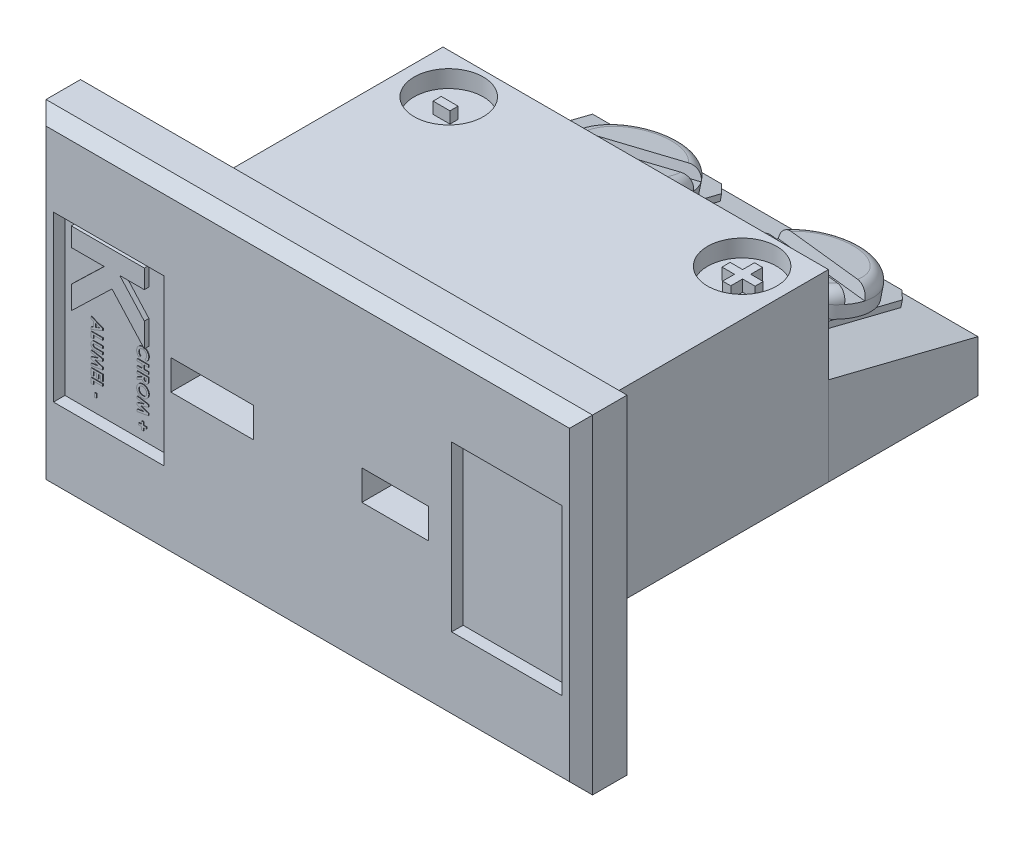
from build123d import *

# Parameters (mm, degrees)
SKETCH1_W                    = 23.75
SKETCH1_H                    = 14.3
SKETCH1_W_2                  = 3.6
SKETCH1_H_2                  = 1.3
SKETCH1_W_3                  = 2.9
EXTRUDE1_DEPTH               = 2
CHAMFER1_SIZE                = 0.5
SKETCH2_W                    = 4.8
SKETCH2_H                    = 7.15
CUT_EXTRUDE1_DEPTH           = 0.5
SKETCH3_W                    = 16.75
SKETCH3_H                    = 8
SKETCH3_W_2                  = 2.9
SKETCH3_H_2                  = 1.3
SKETCH3_W_3                  = 3.6
EXTRUDE2_DEPTH               = 12.25
TC_TYPE_DEPTH                = 0.2
SKETCH5_W                    = 2.9
SKETCH5_H                    = 0.5
CONATCTS_DEPTH               = 12.25
SKETCH5_W_2                  = 3.6
CONATCTS_2_DEPTH             = 12.25
EXTRUDE5_DEPTH               = 6.5
CUT_EXTRUDE2_DEPTH           = 24.317388898
CUT_EXTRUDE2_DEPTH_BACK      = 24.317388898
CONTACT_EXTENSION_DEPTH      = 0.2
CONTACT_EXTENSION_DEPTH_BACK = 0.2
SKETCH8_W                    = 2
SKETCH8_H                    = 2
CONTACT_PLATE_DEPTH          = 0.265
CONTACT_PLATE_DEPTH_BACK     = 0.265
SKETCH10_R                   = 2.25
SCREW_HEAD_DEPTH             = 1
FILLET1_R                    = 0.5
SCREW_SLOT_DEPTH             = 0.5
SKETCH12_R                   = 1.25
SCREW_DEPTH                  = 3.5
SCREW_2_DEPTH                = 3.5
SKETCH13_R                   = 1.5
CUT_EXTRUDE4_DEPTH           = 0.75
POSITIVE_DEPTH               = 0.5
SKETCH16_W                   = 0.732692307
SKETCH16_H                   = 0.352777778
NEGATIVE_DEPTH               = 0.5
TEMINAL_INFO_DEPTH           = 0.025
TEMINAL_INFO_2_DEPTH         = 0.025
TEMINAL_INFO_3_DEPTH         = 0.025
TEMINAL_INFO_4_DEPTH         = 0.025
TEMINAL_INFO_5_DEPTH         = 0.025
TEMINAL_INFO_6_DEPTH         = 0.025
TEMINAL_INFO_7_DEPTH         = 0.025
TEMINAL_INFO_8_DEPTH         = 0.025
TEMINAL_INFO_9_DEPTH         = 0.025
TEMINAL_INFO_10_DEPTH        = 0.025
TEMINAL_INFO_11_DEPTH        = 0.025
TEMINAL_INFO_12_DEPTH        = 0.025
SKETCH17_W                   = 0.083333333
SKETCH17_H                   = 0.173076923
TEMINAL_INFO_13_DEPTH        = 0.025
SKETCH18_W                   = 16.75
SKETCH18_H                   = 0.25
MOUNTING_SLOT_DEPTH          = 3.75


with BuildPart() as part:
    # Sketch1 → Extrude1 (new body)
    with BuildSketch(Plane.XY):
        Rectangle(SKETCH1_W, SKETCH1_H)
        with Locations((-4.15, 0)):
            Rectangle(SKETCH1_W_2, SKETCH1_H_2, mode=Mode.SUBTRACT)
        with Locations((3.8, 0)):
            Rectangle(SKETCH1_W_3, SKETCH1_H_2, mode=Mode.SUBTRACT)
    extrude(amount=EXTRUDE1_DEPTH)

    # Chamfer1
    chamfer1_edges = [part.edges().sort_by_distance(p)[0] for p in [
        (11.875, 0, 2),
        (0, 7.15, 2),
        (-11.875, 0, 2),
        (0, -7.15, 2),
    ]]
    chamfer(chamfer1_edges, length=CHAMFER1_SIZE)

    # Sketch2 → Cut-Extrude1 (cut)
    with BuildSketch(Plane.XY.offset(2)):
        with Locations((8.65, 0)):
            Rectangle(SKETCH2_W, SKETCH2_H)
        with Locations((-8.65, 0)):
            Rectangle(SKETCH2_W, SKETCH2_H)
    extrude(amount=-CUT_EXTRUDE1_DEPTH, mode=Mode.SUBTRACT)

    # Sketch3 → Extrude2 (add)
    with BuildSketch(Plane(origin=(0, 0, 0), x_dir=(-1, 0, 0), z_dir=(0, 0, -1))):
        Rectangle(SKETCH3_W, SKETCH3_H)
        with Locations((-3.8, 0)):
            Rectangle(SKETCH3_W_2, SKETCH3_H_2, mode=Mode.SUBTRACT)
        with Locations((4.15, 0)):
            Rectangle(SKETCH3_W_3, SKETCH3_H_2, mode=Mode.SUBTRACT)
    extrude(amount=EXTRUDE2_DEPTH)

    # Sketch4 → TC Type (add)
    with BuildSketch(Plane(origin=(4.986962707, -4.591876201, 1.5), x_dir=(0, -1, 0), z_dir=(0, 0, 1))):
        Polygon((-7.734521618, -12.389716307), (-6.920419053, -12.389716307), (-6.920419053, -13.455681852), (-5.738062283, -12.389716307), (-4.690541249, -12.389716307), (-6.24814842, -13.79404323), (-4.539169053, -15.564716307), (-5.535172659, -15.564716307), (-6.920419053, -14.12922452), (-6.920419053, -15.564716307), (-7.734521618, -15.564716307), align=None)
    extrude(amount=TC_TYPE_DEPTH)

    # Sketch13 → Cut-Extrude4 (cut)
    with BuildSketch(Plane(origin=(0, 4, 0), x_dir=(1, 0, 0), z_dir=(0, 1, 0))):
        with Locations(Location((6.375, 10.5, 0), (0, 0, 180))):
            Circle(SKETCH13_R)
        with Locations((-6.375, 10.5)):
            Circle(SKETCH13_R)
    extrude(amount=-CUT_EXTRUDE4_DEPTH, mode=Mode.SUBTRACT)

    # Sketch15 → Positive (add)
    with BuildSketch(Plane(origin=(0, 3.25, 0), x_dir=(1, 0, 0), z_dir=(0, 1, 0))):
        Polygon((6.26232318, 10.634212166), (6.26232318, 11.149810456), (6.615100958, 11.149810456), (6.615100958, 10.634212166), (7.157836001, 10.634212166), (7.157836001, 10.281434388), (6.615100958, 10.281434388), (6.615100958, 9.765836098), (6.26232318, 9.765836098), (6.26232318, 10.281434388), (5.719588138, 10.281434388), (5.719588138, 10.634212166), align=None)
    extrude(amount=POSITIVE_DEPTH)

    # Sketch16 → Negative (add)
    with BuildSketch(Plane(origin=(0, 3.25, 0), x_dir=(1, 0, 0), z_dir=(0, 1, 0))):
        with Locations((-6.437463802, 10.426631522)):
            Rectangle(SKETCH16_W, SKETCH16_H)
    extrude(amount=NEGATIVE_DEPTH)

    # Sketch18 → Mounting Slot (cut)
    with BuildSketch(Plane(origin=(0, 4, 0), x_dir=(1, 0, 0), z_dir=(0, 1, 0))):
        with Locations((0, 0.125)):
            Rectangle(SKETCH18_W, SKETCH18_H)
    extrude(amount=-MOUNTING_SLOT_DEPTH, mode=Mode.SUBTRACT)


with BuildPart() as body_2:
    # Sketch5 → Conatcts (new body)
    with BuildSketch(Plane(origin=(0, 0, 0), x_dir=(-1, 0, 0), z_dir=(0, 0, -1))):
        with Locations((-3.8, -0.4)):
            Rectangle(SKETCH5_W, SKETCH5_H)
    extrude(amount=CONATCTS_DEPTH)


with BuildPart() as body_3:
    # Sketch5 → Conatcts 2 (new body)
    with BuildSketch(Plane(origin=(0, 0, 0), x_dir=(-1, 0, 0), z_dir=(0, 0, -1))):
        with Locations((4.15, -0.4)):
            Rectangle(SKETCH5_W_2, SKETCH5_H)
    extrude(amount=CONATCTS_2_DEPTH)


with BuildPart() as body_4:
    # Sketch6 → Extrude5 (new body)
    with BuildSketch(Plane(origin=(0, 0, -12.25), x_dir=(-1, 0, 0), z_dir=(0, 0, -1))):
        Polygon((-8.375, -4), (8.375, -4), (8.375, -0.15), (5.95, -0.15), (5.95, -0.65), (2.35, -0.65), (2.35, -0.15), (-2.35, -0.15), (-2.35, -0.65), (-5.25, -0.65), (-5.25, -0.15), (-8.375, -0.15), align=None)
    extrude(amount=EXTRUDE5_DEPTH)

    # Sketch7 → Cut-Extrude2 (cut, two sides: drawn at the far end of the back side and taken through both)
    with BuildSketch(Plane(origin=(0, 0, 0), x_dir=(0, 0, -1), z_dir=(1, 0, 0)).offset(-CUT_EXTRUDE2_DEPTH_BACK)):
        Polygon((12.25, -0.15), (20.25, -0.15), (20.25, -2.15), align=None)
    extrude(amount=CUT_EXTRUDE2_DEPTH + CUT_EXTRUDE2_DEPTH_BACK, mode=Mode.SUBTRACT)

    # Sketch8 → Contact Extension (add, two sides: drawn at the far end of the back side and taken through both)
    with BuildSketch(Plane(origin=(0, -0.65, 0), x_dir=(-1, 0, 0), z_dir=(0, 1, 0)).offset(-CONTACT_EXTENSION_DEPTH_BACK)):
        with Locations((-3.75, -13.25)):
            Rectangle(SKETCH8_W, SKETCH8_H)
        with Locations((4.15, -13.25)):
            Rectangle(SKETCH8_W, SKETCH8_H)
    extrude(amount=CONTACT_EXTENSION_DEPTH + CONTACT_EXTENSION_DEPTH_BACK)

    # Sketch9 → Contact Plate (add, two sides: drawn at the far end of the back side and taken through both)
    with BuildSketch(Plane(origin=(0, 2.741176471, -0.685294118), x_dir=(-1, 0, 0), z_dir=(0, 0.9701425001453319, -0.24253562503633302)).offset(-CONTACT_PLATE_DEPTH_BACK)):
        Polygon((6.15, -13.982178783), (2.15, -13.982178783), (2.15, -17.920672612), (2.65, -18.420672612), (5.65, -18.420672612), (6.15, -17.920672612), align=None)
        Polygon((-1.8, -13.982178783), (-5.8, -13.982178783), (-5.8, -17.820672612), (-5.3, -18.320672612), (-2.3, -18.320672612), (-1.8, -17.820672612), align=None)
    extrude(amount=CONTACT_PLATE_DEPTH + CONTACT_PLATE_DEPTH_BACK)

    # Sketch10 → Screw Head (add)
    with BuildSketch(Plane(origin=(0, 2.998264233, -0.749566058), x_dir=(-1, 0, 0), z_dir=(0, 0.9701425001453319, -0.2425356250363331))):
        with Locations(Location((-3.75, -15.733671658, 0), (0, 0, 330.073565133))):
            Circle(SKETCH10_R)
        with Locations(Location((4.15, -15.733671658, 0), (0, 0, 332.733955549))):
            Circle(SKETCH10_R)
    extrude(amount=SCREW_HEAD_DEPTH)

    # Fillet1
    fillet1_edges = [body_4.edges().sort_by_distance(p)[0] for p in [
        (5.7, 0.424676407, -15.167022987),
        (-2.15, 0.402430844, -15.256005242),
    ]]
    fillet(fillet1_edges, radius=FILLET1_R)

    # Sketch11 → Screw Slot (cut)
    with BuildSketch(Plane(origin=(0, 3.968406733, -0.992101683), x_dir=(-1, 0, 0), z_dir=(0, 0.9701425001453319, -0.2425356250363331))):
        Polygon((-8.004493959, -15.514840567), (-0.01596153, -16.684812948), (-0.012575312, -15.876774602), (-7.999326122, -14.70706315), align=None)
        Polygon((1.350792573, -16.684812948), (7.832864588, -13.446866174), (8.12818877, -14.193601578), (1.70829056, -17.40049108), align=None)
    extrude(amount=-SCREW_SLOT_DEPTH, mode=Mode.SUBTRACT)


with BuildPart() as body_5:
    # Sketch12 → Screw (new body)
    with BuildSketch(Plane(origin=(0, 2.706110032, -0.825559871), x_dir=(1, 0, 0), z_dir=(0, -0.9701425001453319, 0.24253562503633302))):
        with Locations(Location((3.75, -15.589089029, 0), (0, 0, 270))):
            Circle(SKETCH12_R)
    extrude(amount=SCREW_DEPTH)


with BuildPart() as body_6:
    # Sketch12 → Screw 2 (new body)
    with BuildSketch(Plane(origin=(0, 2.706110032, -0.825559871), x_dir=(1, 0, 0), z_dir=(0, -0.9701425001453319, 0.24253562503633302))):
        with Locations(Location((-4.15, -15.589089029, 0), (0, 0, 270))):
            Circle(SKETCH12_R)
    extrude(amount=SCREW_2_DEPTH)


with BuildPart() as body_7:
    # Sketch17 → Teminal Info (new body)
    with BuildSketch(Plane.XY.offset(1.5)):
        with BuildLine():
            Line((-7.483592845, -0.506410256), (-7.546493486, -0.440604968))
            add(Edge.make_bspline(
                [(-7.546493486, -0.440604968), (-7.54071413, -0.435028804), (-7.529406863, -0.42411908), (-7.514587891, -0.406464723), (-7.502045909, -0.388268799), (-7.491613941, -0.369653666), (-7.483655918, -0.350332043), (-7.477934511, -0.330558235), (-7.474371882, -0.310224747), (-7.473976489, -0.296488723), (-7.473777139, -0.289563301)],
                knots=[0, 0, 0, 0, 1.115306757, 2.182089883, 3.196083701, 4.1824169, 5.141279108, 6.092660653, 7.038358735, 8, 8, 8, 8], degree=3))
            add(Edge.make_bspline(
                [(-7.473777139, -0.289563301), (-7.473937236, -0.283780283), (-7.474253169, -0.272368133), (-7.476569271, -0.255612107), (-7.480507902, -0.239584101), (-7.485936065, -0.224229251), (-7.492959821, -0.209592738), (-7.501573732, -0.195643874), (-7.511700003, -0.182417051), (-7.523286241, -0.170086986), (-7.535945076, -0.158807876), (-7.549452022, -0.148842065), (-7.563776137, -0.140494099), (-7.578772356, -0.133643059), (-7.594510088, -0.128306364), (-7.61097874, -0.124495293), (-7.628197922, -0.122291071), (-7.639903395, -0.121962077), (-7.64585246, -0.121794872)],
                knots=[0, 0, 0, 0, 1.035432265, 2.043311493, 3.022114605, 3.98653278, 4.95457646, 5.923598177, 6.917315552, 7.932509744, 8.948865224, 9.949768934, 10.933144597, 11.912367597, 12.897413939, 13.903909035, 14.934704909, 16, 16, 16, 16], degree=3))
            add(Edge.make_bspline(
                [(-7.64585246, -0.121794872), (-7.650027951, -0.121842997), (-7.658257931, -0.121937853), (-7.670431989, -0.122978422), (-7.682245118, -0.124649316), (-7.693672834, -0.127083956), (-7.704759354, -0.130074039), (-7.715501702, -0.133790095), (-7.725893422, -0.138203266), (-7.735914917, -0.143188526), (-7.745450561, -0.148814873), (-7.754502566, -0.1550235), (-7.762955679, -0.161875245), (-7.77109906, -0.169049995), (-7.778446434, -0.17703378), (-7.785423788, -0.185455709), (-7.791793855, -0.19449511), (-7.797729458, -0.203949724), (-7.802885093, -0.2139052), (-7.807555289, -0.224090351), (-7.811348136, -0.234659895), (-7.81440553, -0.245485063), (-7.817005382, -0.256527191), (-7.818606193, -0.267894276), (-7.819818467, -0.279487781), (-7.819893318, -0.287323044), (-7.819930986, -0.291266026)],
                knots=[0, 0, 0, 0, 1.103757074, 2.175527871, 3.227929046, 4.25632503, 5.262816555, 6.262237806, 7.259082723, 8.246028863, 9.219500025, 10.184246818, 11.145149257, 12.095245763, 13.050780899, 14.010384931, 14.985255937, 15.972438916, 16.959582425, 17.947317807, 18.933039374, 19.924907969, 20.920697008, 21.929431285, 22.958016685, 24, 24, 24, 24], degree=3))
            add(Edge.make_bspline(
                [(-7.819930986, -0.291266026), (-7.819737245, -0.297953901), (-7.819356597, -0.311093838), (-7.816388515, -0.330380264), (-7.811476291, -0.348781927), (-7.805733525, -0.363508292), (-7.800047649, -0.375025441), (-7.794715052, -0.38371427), (-7.788852643, -0.392758887), (-7.782099074, -0.401959236), (-7.774586285, -0.411415905), (-7.766139404, -0.420955828), (-7.757039551, -0.430825026), (-7.75054468, -0.437290169), (-7.747214639, -0.440604968)],
                knots=[0, 0, 0, 0, 1.404522537, 2.759521553, 4.088271485, 5.398566954, 6.072955186, 6.783849712, 7.538645654, 8.336900766, 9.180343671, 10.075042757, 11.013038782, 12, 12, 12, 12], degree=3))
            Line((-7.747214639, -0.440604968), (-7.814221851, -0.504407051))
            add(Edge.make_bspline(
                [(-7.814221851, -0.504407051), (-7.818551923, -0.499922108), (-7.827003297, -0.491168459), (-7.839003457, -0.47796382), (-7.849786945, -0.464775804), (-7.859745106, -0.451922989), (-7.868588004, -0.439194888), (-7.876323878, -0.426592661), (-7.883150451, -0.41425963), (-7.888945407, -0.401937377), (-7.893897329, -0.389528089), (-7.898073536, -0.376765616), (-7.901719079, -0.363643861), (-7.904587933, -0.350054149), (-7.906923378, -0.336057116), (-7.908466589, -0.321607785), (-7.909536709, -0.306773667), (-7.909628245, -0.296743431), (-7.909674575, -0.291666667)],
                knots=[0, 0, 0, 0, 1.244537013, 2.429070097, 3.56066612, 4.644477994, 5.67429546, 6.652817684, 7.595405349, 8.486886006, 9.369351459, 10.26090686, 11.166404474, 12.086719576, 13.0323422, 13.998023148, 14.9867073, 16, 16, 16, 16], degree=3))
            add(Edge.make_bspline(
                [(-7.909674575, -0.291666667), (-7.909436442, -0.282341638), (-7.90897048, -0.26409515), (-7.905529907, -0.23735282), (-7.899723764, -0.211927247), (-7.891623831, -0.187772746), (-7.881106112, -0.164963241), (-7.868344068, -0.1434272), (-7.853216574, -0.123200487), (-7.835949016, -0.10445715), (-7.816874435, -0.087508223), (-7.796401417, -0.072510399), (-7.774382938, -0.060158764), (-7.75129065, -0.049679036), (-7.72676353, -0.041826072), (-7.70102321, -0.036109806), (-7.673959228, -0.032631488), (-7.655478216, -0.032247247), (-7.64605278, -0.032051282)],
                knots=[0, 0, 0, 0, 1.07798487, 2.109316747, 3.111276023, 4.08905949, 5.049398091, 6.009992678, 6.978127636, 7.964347882, 8.951383687, 9.924270623, 10.892397886, 11.86520058, 12.851549246, 13.863953586, 14.910602472, 16, 16, 16, 16], degree=3))
            add(Edge.make_bspline(
                [(-7.64605278, -0.032051282), (-7.639906004, -0.032137697), (-7.627724596, -0.03230895), (-7.609764133, -0.033965988), (-7.592306791, -0.036572287), (-7.575406272, -0.040156215), (-7.558968399, -0.044779643), (-7.543101422, -0.05046187), (-7.527739592, -0.057227999), (-7.512981133, -0.065048174), (-7.498744246, -0.073706162), (-7.485277203, -0.08341883), (-7.472435157, -0.093888593), (-7.460385255, -0.105373564), (-7.44908009, -0.117717352), (-7.438381032, -0.130885951), (-7.428488527, -0.145038501), (-7.41935398, -0.159971493), (-7.411009945, -0.175450468), (-7.403835635, -0.191367184), (-7.39766763, -0.207575259), (-7.392648916, -0.224067746), (-7.38887359, -0.240921074), (-7.386021847, -0.257999263), (-7.384426391, -0.27544381), (-7.384165331, -0.287156449), (-7.38403355, -0.29306891)],
                knots=[0, 0, 0, 0, 1.072042128, 2.124525481, 3.143421661, 4.149789678, 5.136208088, 6.119957821, 7.087418232, 8.061778743, 9.031690376, 9.991741907, 10.955971237, 11.919971873, 12.892764515, 13.874218568, 14.877632952, 15.902487591, 16.926514439, 17.94307752, 18.945815567, 19.949956505, 20.947454389, 21.956649761, 22.968530506, 24, 24, 24, 24], degree=3))
            add(Edge.make_bspline(
                [(-7.38403355, -0.29306891), (-7.384109107, -0.298112836), (-7.384259435, -0.308148246), (-7.385512583, -0.323092654), (-7.387480641, -0.337917544), (-7.39045002, -0.352569838), (-7.393975048, -0.367154344), (-7.398590587, -0.381479406), (-7.403735474, -0.395771008), (-7.409885137, -0.409805009), (-7.416598049, -0.423600998), (-7.424214091, -0.436835782), (-7.432264582, -0.449731572), (-7.441225983, -0.462002604), (-7.450773249, -0.473878743), (-7.460950922, -0.485297885), (-7.471928694, -0.496159823), (-7.479685139, -0.502976172), (-7.483592845, -0.506410256)],
                knots=[0, 0, 0, 0, 0.996412454, 1.982464992, 2.961075852, 3.949442424, 4.934965278, 5.923860011, 6.921385422, 7.934793307, 8.949617135, 9.951082467, 10.950285876, 11.951772932, 12.951063433, 13.960125323, 14.972308753, 16, 16, 16, 16], degree=3))
        make_face()
    extrude(amount=TEMINAL_INFO_DEPTH)


with BuildPart() as body_8:
    # Sketch17 → Teminal Info 2 (new body)
    with BuildSketch(Plane.XY.offset(1.5)):
        Polygon((-7.396854062, -0.596153846), (-7.396854062, -0.685897436), (-7.589161755, -0.685897436), (-7.589161755, -0.858974359), (-7.396854062, -0.858974359), (-7.396854062, -0.948717949), (-7.896854062, -0.948717949), (-7.896854062, -0.858974359), (-7.678905345, -0.858974359), (-7.678905345, -0.685897436), (-7.896854062, -0.685897436), (-7.896854062, -0.596153846), align=None)
    extrude(amount=TEMINAL_INFO_2_DEPTH)


with BuildPart() as body_9:
    # Sketch17 → Teminal Info 3 (new body)
    with BuildSketch(Plane.XY.offset(1.5)):
        with BuildLine():
            Line((-7.396854062, -1.064102564), (-7.396854062, -1.168669872))
            add(Edge.make_bspline(
                [(-7.396854062, -1.168669872), (-7.39687852, -1.17558175), (-7.39692556, -1.188875239), (-7.397670998, -1.208043547), (-7.398703601, -1.2256529), (-7.400298682, -1.241759527), (-7.402361311, -1.256299702), (-7.4048637, -1.26930422), (-7.407690718, -1.280780634), (-7.411155667, -1.29088394), (-7.415145939, -1.299976519), (-7.419649809, -1.308428349), (-7.424837463, -1.316388412), (-7.430498699, -1.324002812), (-7.436836283, -1.331135638), (-7.443798856, -1.337767125), (-7.451336233, -1.343982543), (-7.459403088, -1.349790118), (-7.467988161, -1.354958196), (-7.47696955, -1.359536858), (-7.486371526, -1.363298659), (-7.496140263, -1.366430917), (-7.50628751, -1.368842564), (-7.516806678, -1.370479983), (-7.527702239, -1.371690705), (-7.535105051, -1.371759685), (-7.538881306, -1.371794872)],
                knots=[0, 0, 0, 0, 1.749037589, 3.363891962, 4.853828513, 6.212420965, 7.458679178, 8.568887289, 9.562757098, 10.447168552, 11.268163578, 12.073310924, 12.867792413, 13.67045336, 14.472446998, 15.279188696, 16.101356728, 16.943088626, 17.792208908, 18.634830833, 19.491484118, 20.351879174, 21.228996054, 22.12769993, 23.044919519, 24, 24, 24, 24], degree=3))
            add(Edge.make_bspline(
                [(-7.538881306, -1.371794872), (-7.542822772, -1.371702877), (-7.550551267, -1.371522493), (-7.561903797, -1.370550843), (-7.572765103, -1.368774972), (-7.583103385, -1.366085158), (-7.593047315, -1.362993566), (-7.602413422, -1.358882541), (-7.611337922, -1.354242843), (-7.619694573, -1.34873241), (-7.627668995, -1.342684979), (-7.634955658, -1.335651943), (-7.641946192, -1.328088936), (-7.648202733, -1.319570814), (-7.654148328, -1.310473062), (-7.659536619, -1.30061492), (-7.664503058, -1.290060723), (-7.667272687, -1.2826406), (-7.668688998, -1.278846154)],
                knots=[0, 0, 0, 0, 1.099860209, 2.156625411, 3.176576793, 4.16617041, 5.135385252, 6.078461593, 7.016046972, 7.938469504, 8.868247731, 9.803980173, 10.76021508, 11.73834243, 12.748633912, 13.790971185, 14.870363756, 16, 16, 16, 16], degree=3))
            Line((-7.668688998, -1.278846154), (-7.896854062, -1.394230769))
            Line((-7.896854062, -1.394230769), (-7.896854062, -1.294471154))
            Line((-7.896854062, -1.294471154), (-7.678905345, -1.184294872))
            Line((-7.678905345, -1.184294872), (-7.678905345, -1.153846154))
            Line((-7.678905345, -1.153846154), (-7.896854062, -1.153846154))
            Line((-7.896854062, -1.153846154), (-7.896854062, -1.064102564))
            Line((-7.896854062, -1.064102564), (-7.396854062, -1.064102564))
        make_face()
        with BuildLine():
            Line((-7.589161755, -1.153846154), (-7.589161755, -1.188802083))
            add(Edge.make_bspline(
                [(-7.589161755, -1.188802083), (-7.589113623, -1.193075737), (-7.58902146, -1.201258865), (-7.588593957, -1.213027268), (-7.587563937, -1.223715822), (-7.58626241, -1.233370264), (-7.584760035, -1.242039701), (-7.582605592, -1.249645122), (-7.580301258, -1.256309063), (-7.577423843, -1.261935844), (-7.57420914, -1.266762854), (-7.570396027, -1.270808875), (-7.566218964, -1.274373274), (-7.561415044, -1.277169219), (-7.556181084, -1.279428163), (-7.550418611, -1.280829087), (-7.544231961, -1.281940587), (-7.539922129, -1.282013395), (-7.537679383, -1.282051282)],
                knots=[0, 0, 0, 0, 1.688935225, 3.233948049, 4.651771667, 5.929878493, 7.083962697, 8.124219224, 9.050753627, 9.864999381, 10.615157594, 11.334035464, 12.05533055, 12.777108108, 13.522027315, 14.29964284, 15.115170198, 16, 16, 16, 16], degree=3))
            add(Edge.make_bspline(
                [(-7.537679383, -1.282051282), (-7.535029504, -1.281949492), (-7.529824308, -1.281749545), (-7.522330753, -1.279765336), (-7.515394557, -1.27660715), (-7.509049, -1.272277247), (-7.50348031, -1.266827654), (-7.498611429, -1.260584386), (-7.494671659, -1.253455339), (-7.492148435, -1.246807387), (-7.490597498, -1.240717091), (-7.489496534, -1.235238659), (-7.488642889, -1.228877365), (-7.487816498, -1.221668705), (-7.487247673, -1.213581679), (-7.486845199, -1.204631221), (-7.486678199, -1.194812274), (-7.486625274, -1.187967427), (-7.486597652, -1.184395032)],
                knots=[0, 0, 0, 0, 1.020213939, 2.004021227, 2.966357326, 3.948562114, 4.950324333, 5.960000531, 6.991850424, 8.080015304, 8.69218159, 9.414443227, 10.233931419, 11.166782034, 12.212677862, 13.359889063, 14.622099264, 16, 16, 16, 16], degree=3))
            Line((-7.486597652, -1.184395032), (-7.486597652, -1.153846154))
            Line((-7.486597652, -1.153846154), (-7.589161755, -1.153846154))
        make_face(mode=Mode.SUBTRACT)
    extrude(amount=TEMINAL_INFO_3_DEPTH)


with BuildPart() as body_10:
    # Sketch17 → Teminal Info 4 (new body)
    with BuildSketch(Plane.XY.offset(1.5)):
        with BuildLine():
            add(Edge.make_bspline(
                [(-7.38403355, -1.702924679), (-7.384258496, -1.711617863), (-7.38470259, -1.728780175), (-7.388408608, -1.754018524), (-7.394436717, -1.778345077), (-7.402862926, -1.801754679), (-7.413739558, -1.824215536), (-7.427111392, -1.845670065), (-7.442770264, -1.866256774), (-7.460687412, -1.885595599), (-7.480266497, -1.903334506), (-7.501141363, -1.918931113), (-7.5230791, -1.932134612), (-7.546060256, -1.94293211), (-7.570132692, -1.951293091), (-7.595283838, -1.957129265), (-7.621467271, -1.960887516), (-7.639295587, -1.961319112), (-7.648356466, -1.961538462)],
                knots=[0, 0, 0, 0, 1.014244935, 2.002349224, 2.970143685, 3.935298574, 4.900830986, 5.877310296, 6.881148894, 7.915268703, 8.949887647, 9.960720774, 10.951801935, 11.933244874, 12.919141415, 13.920101769, 14.942934067, 16, 16, 16, 16], degree=3))
            add(Edge.make_bspline(
                [(-7.648356466, -1.961538462), (-7.65731526, -1.961304865), (-7.67496885, -1.960844556), (-7.700910849, -1.957282429), (-7.725793102, -1.951348521), (-7.749629871, -1.943126113), (-7.772426329, -1.932536491), (-7.794158668, -1.919566058), (-7.814744045, -1.904096445), (-7.834131948, -1.886637353), (-7.851725223, -1.867416005), (-7.867271506, -1.847049892), (-7.880350483, -1.825579515), (-7.891152549, -1.803156617), (-7.899503651, -1.779683155), (-7.905401572, -1.755212417), (-7.908984487, -1.729740258), (-7.909442233, -1.712418164), (-7.909674575, -1.703625801)],
                knots=[0, 0, 0, 0, 1.051446269, 2.071908608, 3.067230498, 4.050151293, 5.026863609, 6.012936299, 7.01551645, 8.045060801, 9.071444569, 10.070117656, 11.048150216, 12.017576978, 12.987003741, 13.967083865, 14.968130643, 16, 16, 16, 16], degree=3))
            add(Edge.make_bspline(
                [(-7.909674575, -1.703625801), (-7.909466179, -1.694430025), (-7.909056708, -1.676361581), (-7.905162831, -1.649918333), (-7.899297292, -1.624583416), (-7.89054329, -1.600569658), (-7.879600051, -1.577632501), (-7.866122796, -1.555940469), (-7.850133797, -1.535500853), (-7.832042539, -1.516430898), (-7.812246734, -1.499153473), (-7.791334222, -1.483902756), (-7.769464756, -1.471038438), (-7.7466281, -1.460560048), (-7.722966178, -1.452299306), (-7.698334884, -1.446472291), (-7.67279329, -1.443030135), (-7.65544493, -1.442550662), (-7.646653742, -1.442307692)],
                knots=[0, 0, 0, 0, 1.067978421, 2.098431617, 3.099715153, 4.085208694, 5.062210972, 6.048429807, 7.046490867, 8.072918869, 9.098532598, 10.095778865, 11.076610158, 12.041847152, 13.011192615, 13.984257998, 14.978533688, 16, 16, 16, 16], degree=3))
            add(Edge.make_bspline(
                [(-7.646653742, -1.442307692), (-7.640739739, -1.44238498), (-7.628986618, -1.442538578), (-7.611564722, -1.444349037), (-7.594507263, -1.447032479), (-7.577784925, -1.45071215), (-7.561460508, -1.45563826), (-7.545499336, -1.461704695), (-7.529839413, -1.468683313), (-7.514631874, -1.47681586), (-7.500023421, -1.485864024), (-7.486080971, -1.49573482), (-7.472974247, -1.506455247), (-7.46061455, -1.517988603), (-7.449092235, -1.530381163), (-7.43819251, -1.543466812), (-7.428354798, -1.557572614), (-7.419121008, -1.572239828), (-7.410846848, -1.587442995), (-7.403716918, -1.603094981), (-7.397567978, -1.618955728), (-7.39268679, -1.635215744), (-7.388716419, -1.651686087), (-7.386089521, -1.668539062), (-7.384264082, -1.685623389), (-7.384110576, -1.697143896), (-7.38403355, -1.702924679)],
                knots=[0, 0, 0, 0, 1.034751683, 2.056401036, 3.062285641, 4.056148242, 5.050783641, 6.043890034, 7.043081327, 8.049576835, 9.059882113, 10.048974407, 11.037410495, 12.021414423, 13.005418351, 13.997561464, 14.999568372, 16.012961702, 17.030138968, 18.026421002, 19.021605583, 20.005054086, 20.995836695, 21.984410968, 22.988613675, 24, 24, 24, 24], degree=3))
        make_face()
        with BuildLine():
            add(Edge.make_bspline(
                [(-7.473777139, -1.701522436), (-7.473934121, -1.695671972), (-7.474243939, -1.684125499), (-7.476604329, -1.66718892), (-7.480374155, -1.650929224), (-7.485834649, -1.635436459), (-7.49278466, -1.6206438), (-7.501199062, -1.606523817), (-7.511370307, -1.59327662), (-7.522740171, -1.580707911), (-7.535461145, -1.56939244), (-7.548945307, -1.559218299), (-7.563517107, -1.550992093), (-7.57869659, -1.54391873), (-7.594867629, -1.538693957), (-7.61176777, -1.534715838), (-7.629570504, -1.532549091), (-7.641673776, -1.532219583), (-7.647855665, -1.532051282)],
                knots=[0, 0, 0, 0, 1.033668485, 2.040047952, 3.016132939, 3.979056467, 4.937231767, 5.900589077, 6.877725736, 7.88429546, 8.891280164, 9.882584218, 10.863295226, 11.842887319, 12.837417301, 13.860812229, 14.907384602, 16, 16, 16, 16], degree=3))
            add(Edge.make_bspline(
                [(-7.647855665, -1.532051282), (-7.654708692, -1.532255397), (-7.66813949, -1.532655427), (-7.687739168, -1.535441946), (-7.70621016, -1.540281719), (-7.723616205, -1.547015476), (-7.739868368, -1.555774113), (-7.7550543, -1.566392664), (-7.769099935, -1.578965342), (-7.777305013, -1.588639582), (-7.781469447, -1.593549679)],
                knots=[0, 0, 0, 0, 1.078379799, 2.113445728, 3.107478808, 4.077334175, 5.043482131, 6.005506737, 6.987708079, 8, 8, 8, 8], degree=3))
            add(Edge.make_bspline(
                [(-7.781469447, -1.593549679), (-7.784545638, -1.597572719), (-7.790628714, -1.605528159), (-7.798425423, -1.618226773), (-7.805107981, -1.631303845), (-7.810507408, -1.644858058), (-7.814754507, -1.658860786), (-7.817728681, -1.673310108), (-7.819595232, -1.688185552), (-7.81981832, -1.698245025), (-7.819930986, -1.703325321)],
                knots=[0, 0, 0, 0, 1.023928204, 2.024787132, 3.009472467, 3.9914905, 4.972207045, 5.96565515, 6.972602802, 8, 8, 8, 8], degree=3))
            add(Edge.make_bspline(
                [(-7.819930986, -1.703325321), (-7.819772682, -1.709075192), (-7.819461214, -1.720388244), (-7.817129762, -1.737009447), (-7.813184729, -1.752933473), (-7.807770519, -1.768257246), (-7.800739315, -1.782943776), (-7.792026833, -1.796916704), (-7.78188582, -1.810278243), (-7.770319917, -1.82282497), (-7.75759291, -1.834283349), (-7.743968178, -1.844309558), (-7.729618243, -1.852826271), (-7.71453281, -1.859730966), (-7.69871687, -1.86521862), (-7.682148092, -1.868942114), (-7.664886056, -1.871341734), (-7.653138958, -1.871641937), (-7.647154543, -1.871794872)],
                knots=[0, 0, 0, 0, 1.026250569, 2.01918027, 2.989144455, 3.950556051, 4.91558185, 5.889785058, 6.885144561, 7.905911388, 8.931486752, 9.937601838, 10.920932928, 11.905004308, 12.894547393, 13.903711934, 14.932071819, 16, 16, 16, 16], degree=3))
            add(Edge.make_bspline(
                [(-7.647154543, -1.871794872), (-7.641204513, -1.871636694), (-7.629492785, -1.871325347), (-7.612275529, -1.868989908), (-7.595778429, -1.865069469), (-7.579974544, -1.859640585), (-7.564848381, -1.852708188), (-7.550453131, -1.844135576), (-7.536802713, -1.833952828), (-7.523990147, -1.822394302), (-7.512216219, -1.809813556), (-7.501998591, -1.796306868), (-7.493119796, -1.78225217), (-7.486164507, -1.76732698), (-7.480623243, -1.751836653), (-7.476542577, -1.735686668), (-7.47426052, -1.718815855), (-7.473939703, -1.707338292), (-7.473777139, -1.701522436)],
                knots=[0, 0, 0, 0, 1.055025985, 2.07665775, 3.074803781, 4.057872707, 5.035505728, 6.020516407, 7.023567878, 8.050795229, 9.077271434, 10.074415901, 11.050397877, 12.019801805, 12.988065821, 13.964604439, 14.968634123, 16, 16, 16, 16], degree=3))
        make_face(mode=Mode.SUBTRACT)
    extrude(amount=TEMINAL_INFO_4_DEPTH)


with BuildPart() as body_11:
    # Sketch17 → Teminal Info 5 (new body)
    with BuildSketch(Plane.XY.offset(1.5)):
        Polygon((-7.396854062, -2.090845353), (-7.396854062, -2.183994391), (-7.745612075, -2.298076923), (-7.396854062, -2.412960737), (-7.396854062, -2.505208333), (-7.896854062, -2.58974359), (-7.896854062, -2.498898237), (-7.581048774, -2.445512821), (-7.896854062, -2.341546474), (-7.896854062, -2.25400641), (-7.581048774, -2.150641026), (-7.896854062, -2.097355769), (-7.896854062, -2.006410256), align=None)
    extrude(amount=TEMINAL_INFO_5_DEPTH)


with BuildPart() as body_12:
    # Sketch17 → Teminal Info 6 (new body)
    with BuildSketch(Plane.XY.offset(1.5)):
        Polygon((-7.61480278, -2.974358974), (-7.493007909, -2.974358974), (-7.493007909, -3.057692308), (-7.61480278, -3.057692308), (-7.61480278, -3.185897436), (-7.698136114, -3.185897436), (-7.698136114, -3.057692308), (-7.819930986, -3.057692308), (-7.819930986, -2.974358974), (-7.698136114, -2.974358974), (-7.698136114, -2.846153846), (-7.61480278, -2.846153846), align=None)
    extrude(amount=TEMINAL_INFO_6_DEPTH)


with BuildPart() as body_13:
    # Sketch17 → Teminal Info 7 (new body)
    with BuildSketch(Plane.XY.offset(1.5)):
        Polygon((-9.38480913, -0.211638622), (-9.38480913, -0.294871795), (-9.88480913, -0.496794872), (-9.88480913, -0.400941506), (-9.782245028, -0.362079327), (-9.782245028, -0.144230769), (-9.88480913, -0.10536859), (-9.88480913, -0.009615385), align=None)
        Polygon((-9.518923714, -0.253205128), (-9.692501438, -0.178285256), (-9.692501438, -0.328125), align=None, mode=Mode.SUBTRACT)
    extrude(amount=TEMINAL_INFO_7_DEPTH)


with BuildPart() as body_14:
    # Sketch17 → Teminal Info 8 (new body)
    with BuildSketch(Plane.XY.offset(1.5)):
        Polygon((-9.38480913, -0.570512821), (-9.38480913, -0.66025641), (-9.795065541, -0.66025641), (-9.795065541, -0.801282051), (-9.88480913, -0.801282051), (-9.88480913, -0.570512821), align=None)
    extrude(amount=TEMINAL_INFO_8_DEPTH)


with BuildPart() as body_15:
    # Sketch17 → Teminal Info 9 (new body)
    with BuildSketch(Plane.XY.offset(1.5)):
        with BuildLine():
            Line((-9.38480913, -0.878205128), (-9.38480913, -0.967948718))
            Line((-9.38480913, -0.967948718), (-9.710129643, -0.967948718))
            add(Edge.make_bspline(
                [(-9.710129643, -0.967948718), (-9.713502425, -0.967953598), (-9.720016919, -0.967963023), (-9.729363084, -0.968434859), (-9.737954167, -0.968866621), (-9.745780762, -0.969645643), (-9.752846217, -0.970796526), (-9.759195918, -0.971910955), (-9.764716181, -0.973419226), (-9.770999685, -0.975685915), (-9.778059545, -0.979178139), (-9.785417493, -0.98488424), (-9.792132689, -0.991468592), (-9.797722164, -0.999360316), (-9.802243545, -1.008229917), (-9.805593388, -1.01802866), (-9.807455456, -1.028742731), (-9.807739734, -1.036150923), (-9.807886053, -1.039963942)],
                knots=[0, 0, 0, 0, 1.155499968, 2.231836252, 3.205919964, 4.102923608, 4.924856345, 5.658536265, 6.31071849, 6.882491295, 7.94666036, 8.992281882, 10.060072772, 11.158554251, 12.289267114, 13.461410017, 14.693379945, 16, 16, 16, 16], degree=3))
            add(Edge.make_bspline(
                [(-9.807886053, -1.039963942), (-9.807769121, -1.044015284), (-9.807541122, -1.051914713), (-9.805254823, -1.06329987), (-9.801699104, -1.073877642), (-9.796520647, -1.083359023), (-9.790407658, -1.091778225), (-9.783269994, -1.098763179), (-9.775472438, -1.104515811), (-9.768130888, -1.108131885), (-9.761437904, -1.110229591), (-9.755406242, -1.111602574), (-9.74834921, -1.112784079), (-9.740298064, -1.113790146), (-9.731200629, -1.114410955), (-9.72112254, -1.115076298), (-9.709997216, -1.11532133), (-9.702250333, -1.115362925), (-9.698210573, -1.115384615)],
                knots=[0, 0, 0, 0, 1.260838023, 2.458420682, 3.603291091, 4.724957099, 5.81103668, 6.833527554, 7.823976978, 8.819602765, 9.36572267, 10.006654001, 10.745469399, 11.594489782, 12.533565386, 13.586096035, 14.741223574, 16, 16, 16, 16], degree=3))
            Line((-9.698210573, -1.115384615), (-9.38480913, -1.115384615))
            Line((-9.38480913, -1.115384615), (-9.38480913, -1.205128205))
            Line((-9.38480913, -1.205128205), (-9.683086374, -1.205128205))
            add(Edge.make_bspline(
                [(-9.683086374, -1.205128205), (-9.689129568, -1.205117356), (-9.700750042, -1.205096493), (-9.717447699, -1.204707218), (-9.732706603, -1.20399411), (-9.746499094, -1.203108918), (-9.758864574, -1.202047395), (-9.769796734, -1.200673599), (-9.779289714, -1.198993058), (-9.790095051, -1.196474391), (-9.802537367, -1.192133719), (-9.816864029, -1.185133681), (-9.830890632, -1.176248137), (-9.844463362, -1.165745934), (-9.857070366, -1.153887163), (-9.86814353, -1.140938606), (-9.877472577, -1.127116661), (-9.884955178, -1.112308711), (-9.890737241, -1.096409015), (-9.894603885, -1.079305863), (-9.897249093, -1.061046073), (-9.89750025, -1.048454267), (-9.897629643, -1.041967147)],
                knots=[0, 0, 0, 0, 1.170789758, 2.251314523, 3.23554622, 4.130075238, 4.928857907, 5.639700176, 6.263954887, 6.795817153, 7.787924184, 8.809125334, 9.87873356, 10.999178519, 12.129364722, 13.22595565, 14.293390689, 15.352147651, 16.432536881, 17.562186165, 18.74407303, 20, 20, 20, 20], degree=3))
            add(Edge.make_bspline(
                [(-9.897629643, -1.041967147), (-9.897557038, -1.037657078), (-9.897413789, -1.0291534), (-9.896150958, -1.016647182), (-9.894289442, -1.004557725), (-9.891575771, -0.992906537), (-9.888062854, -0.981657583), (-9.883776448, -0.970825575), (-9.878615884, -0.960479987), (-9.872812829, -0.950584492), (-9.866451945, -0.941189415), (-9.859517874, -0.932514688), (-9.852307892, -0.924438805), (-9.844672935, -0.917107034), (-9.836641531, -0.910472048), (-9.828204409, -0.904540436), (-9.819359976, -0.899322866), (-9.809949435, -0.894687601), (-9.799494313, -0.890720291), (-9.787622764, -0.887375693), (-9.774148699, -0.884453776), (-9.759041767, -0.882282378), (-9.742351756, -0.880313777), (-9.724035188, -0.879067761), (-9.704091536, -0.878415914), (-9.690265015, -0.878277165), (-9.683086374, -0.878205128)],
                knots=[0, 0, 0, 0, 1.001195678, 1.975338534, 2.91783225, 3.841754112, 4.752027347, 5.653798756, 6.545402703, 7.435486725, 8.317659034, 9.179053568, 10.013983148, 10.831468265, 11.636005169, 12.432309474, 13.225243684, 14.019732185, 14.86686161, 15.819485008, 16.883051984, 18.067941734, 19.364090787, 20.787286826, 22.331979793, 24, 24, 24, 24], degree=3))
            Line((-9.683086374, -0.878205128), (-9.38480913, -0.878205128))
        make_face()
    extrude(amount=TEMINAL_INFO_9_DEPTH)


with BuildPart() as body_16:
    # Sketch17 → Teminal Info 10 (new body)
    with BuildSketch(Plane.XY.offset(1.5)):
        Polygon((-9.38480913, -1.360076122), (-9.38480913, -1.45322516), (-9.733567143, -1.567307692), (-9.38480913, -1.682191506), (-9.38480913, -1.774439103), (-9.88480913, -1.858974359), (-9.88480913, -1.768129006), (-9.569003842, -1.71474359), (-9.88480913, -1.610777244), (-9.88480913, -1.523237179), (-9.569003842, -1.419871795), (-9.88480913, -1.366586538), (-9.88480913, -1.275641026), align=None)
    extrude(amount=TEMINAL_INFO_10_DEPTH)


with BuildPart() as body_17:
    # Sketch17 → Teminal Info 11 (new body)
    with BuildSketch(Plane.XY.offset(1.5)):
        Polygon((-9.38480913, -1.942307692), (-9.38480913, -2.211538462), (-9.47455272, -2.211538462), (-9.47455272, -2.032051282), (-9.570706566, -2.032051282), (-9.570706566, -2.211538462), (-9.660450156, -2.211538462), (-9.660450156, -2.032051282), (-9.795065541, -2.032051282), (-9.795065541, -2.211538462), (-9.88480913, -2.211538462), (-9.88480913, -1.942307692), align=None)
    extrude(amount=TEMINAL_INFO_11_DEPTH)


with BuildPart() as body_18:
    # Sketch17 → Teminal Info 12 (new body)
    with BuildSketch(Plane.XY.offset(1.5)):
        Polygon((-9.38480913, -2.301282051), (-9.38480913, -2.391025641), (-9.795065541, -2.391025641), (-9.795065541, -2.532051282), (-9.88480913, -2.532051282), (-9.88480913, -2.301282051), align=None)
    extrude(amount=TEMINAL_INFO_12_DEPTH)


with BuildPart() as body_19:
    # Sketch17 → Teminal Info 13 (new body)
    with BuildSketch(Plane.XY.offset(1.5)):
        with Locations((-9.702116823, -2.887820513)):
            Rectangle(SKETCH17_W, SKETCH17_H)
    extrude(amount=TEMINAL_INFO_13_DEPTH)


solid = Compound([part.part, body_2.part, body_3.part, body_4.part, body_5.part, body_6.part, body_7.part, body_8.part, body_9.part, body_10.part, body_11.part, body_12.part, body_13.part, body_14.part, body_15.part, body_16.part, body_17.part, body_18.part, body_19.part])
